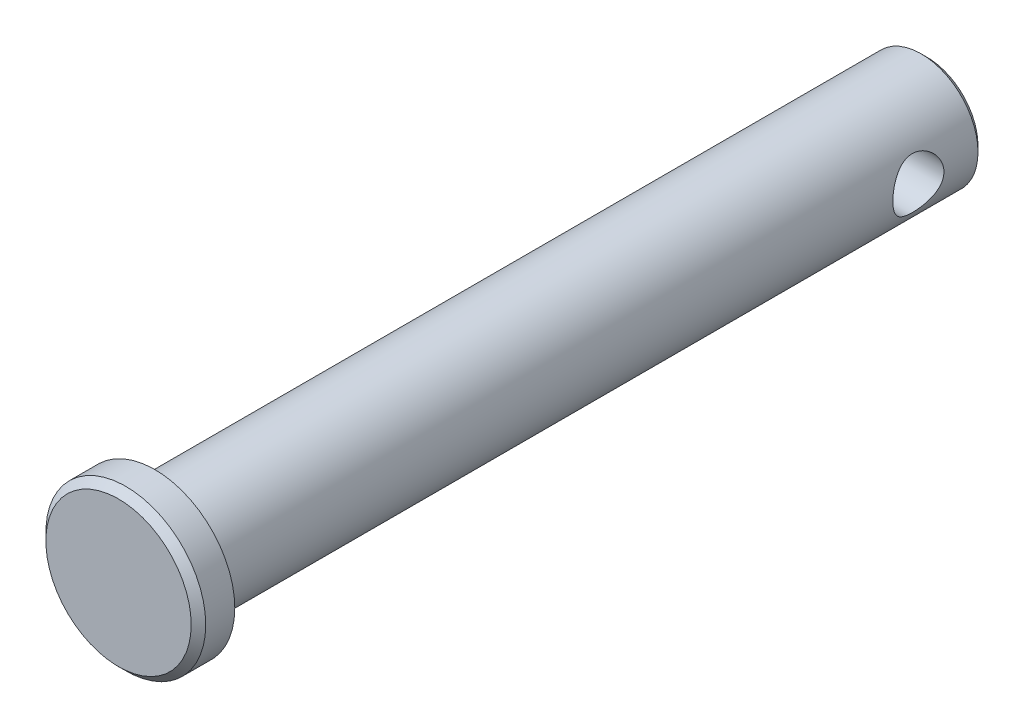
from build123d import *

# Parameters (mm, degrees)
SKETCH1_R           = 3.96875
EXTRUDE1_DEPTH      = 26.9875
SKETCH2_R           = 5.588
EXTRUDE2_DEPTH      = 2.54
CHAMFER1_SIZE       = 0.508
EXTRUDE3_DEPTH      = 31.566726096
EXTRUDE3_DEPTH_BACK = 31.566726096
SKETCH3_R           = 1.7859375
CHAMFER2_SIZE       = 0.396875


with BuildPart() as part:
    # Sketch1 → Extrude1 (new, symmetric)
    with BuildSketch(Plane.XY):
        Circle(SKETCH1_R)
    extrude(amount=EXTRUDE1_DEPTH, both=True)

    # Sketch2 → Extrude2 (add)
    with BuildSketch(Plane.XY.offset(26.9875)):
        Circle(SKETCH2_R)
    extrude(amount=EXTRUDE2_DEPTH)

    # Chamfer1
    chamfer1_edges = [part.edges().sort_by_distance(p)[0] for p in [
        (-5.588, 0, 29.5275),
    ]]
    chamfer(chamfer1_edges, length=CHAMFER1_SIZE)

    # Sketch3 → Extrude3 (cut, two sides: drawn at the far end of the back side and taken through both)
    with BuildSketch(Plane(origin=(0, 0, 0), x_dir=(0, 0, -1), z_dir=(1, 0, 0)).offset(-EXTRUDE3_DEPTH_BACK)):
        with Locations(Location((22.4234375, 0, 0), (0, 0, 179.999999999))):
            Circle(SKETCH3_R)
    extrude(amount=EXTRUDE3_DEPTH + EXTRUDE3_DEPTH_BACK, mode=Mode.SUBTRACT)

    # Chamfer2
    chamfer2_edges = [part.edges().sort_by_distance(p)[0] for p in [
        (-3.96875, 0, -26.9875),
    ]]
    chamfer(chamfer2_edges, length=CHAMFER2_SIZE)


solid = part.part
